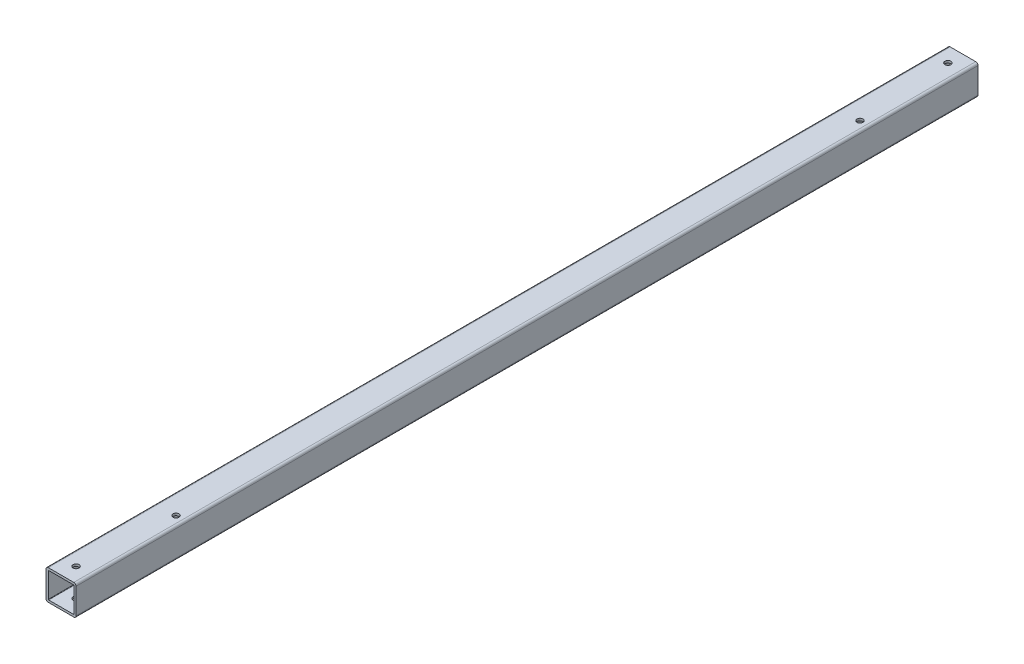
from build123d import *

# Parameters (mm, degrees)
SKETCH1_W                = 40
SKETCH1_H                = 40
SKETCH1_W_2              = 34
SKETCH1_H_2              = 34
EXTRUDE_THIN1_DEPTH      = 1200
FILLET1_R                = 0.5
FILLET2_R                = 3
F_8_0_8_DIAMETER_HOLE1_D = 8
F_8_0_8_DIAMETER_HOLE2_D = 8


with BuildPart() as part:
    # Sketch1 → Extrude-Thin1 (new body)
    with BuildSketch(Plane.XY):
        Rectangle(SKETCH1_W, SKETCH1_H)
        Rectangle(SKETCH1_W_2, SKETCH1_H_2, mode=Mode.SUBTRACT)
    extrude(amount=EXTRUDE_THIN1_DEPTH)

    # Fillet1
    fillet1_edges = [part.edges().sort_by_distance(p)[0] for p in [
        (17, -17, 600),
        (17, 17, 600),
        (-17, 17, 600),
        (-17, -17, 600),
    ]]
    fillet(fillet1_edges, radius=FILLET1_R)

    # Fillet2
    fillet2_edges = [part.edges().sort_by_distance(p)[0] for p in [
        (20, -20, 600),
        (-20, -20, 600),
        (-20, 20, 600),
        (20, 20, 600),
    ]]
    fillet(fillet2_edges, radius=FILLET2_R)

    # Ø8.0 (8) Diameter Hole1 (through all)
    with Locations(Plane(origin=(0, 20, 0), x_dir=(1, 0, 0), z_dir=(0, 1, 0))):
        with Locations((0, -20), (0, -1180)):
            Hole(F_8_0_8_DIAMETER_HOLE1_D / 2)

    # Ø8.0 (8) Diameter Hole2 (through all)
    with Locations(Plane(origin=(0, 20, 0), x_dir=(1, 0, 0), z_dir=(0, 1, 0))):
        with Locations((8, -1055), (8, -145)):
            Hole(F_8_0_8_DIAMETER_HOLE2_D / 2)


solid = part.part
